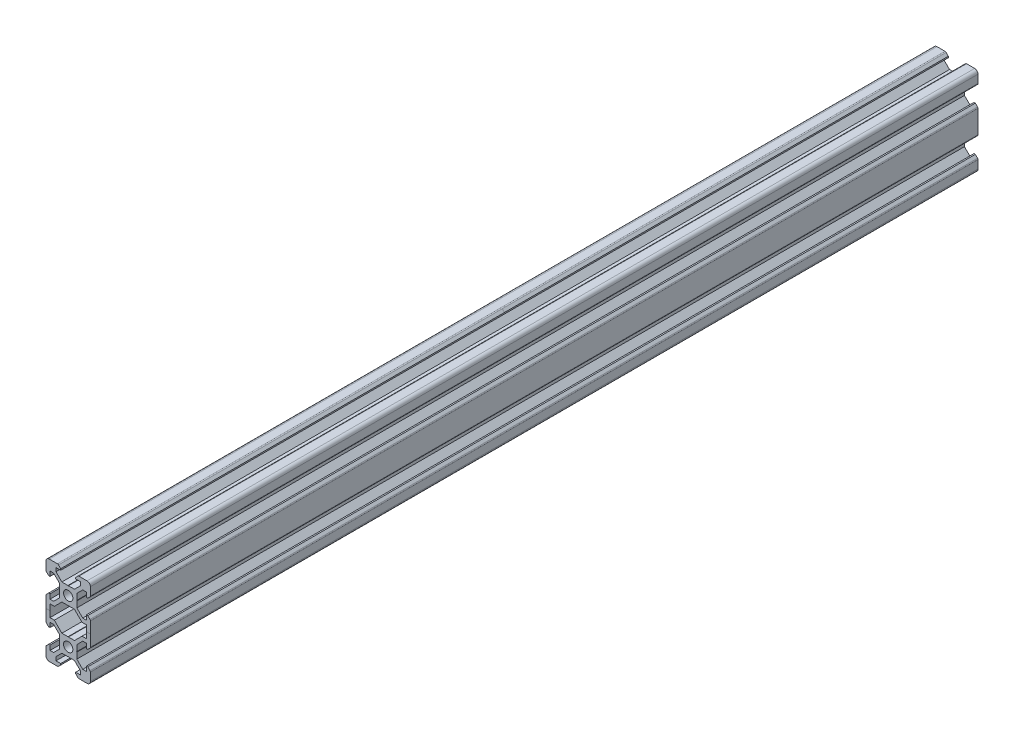
from build123d import *

# Parameters (mm, degrees)
SKETCH1_R           = 2.1
BOSS_EXTRUDE2_DEPTH = 400


with BuildPart() as part:
    # Sketch1 → Boss-Extrude2 (new body)
    with BuildSketch(Plane.XY):
        with BuildLine():
            Line((-8.5, 10), (-4.862792737, 10))
            ThreePointArc((-4.862792737, 10), (-4.598292737, 9.947387679), (-4.374060464, 9.797560464))
            Line((-4.374060464, 9.797560464), (-3.3865, 8.81))
            Line((-3.3865, 8.81), (-3.3865, 8.2))
            Line((-3.3865, 8.2), (-5.5, 8.2))
            Line((-5.5, 8.2), (-5.5, 6.561))
            Line((-5.5, 6.561), (-2.8395, 3.9005))
            Line((-2.8395, 3.9005), (-0.1, 3.9005))
            Line((-0.1, 3.9005), (0, 3.8005))
            Line((0, 3.8005), (0.1, 3.9005))
            Line((0.1, 3.9005), (2.8395, 3.9005))
            Line((2.8395, 3.9005), (5.5, 6.561))
            Line((5.5, 6.561), (5.5, 8.2))
            Line((5.5, 8.2), (3.3865, 8.2))
            Line((3.3865, 8.2), (3.3865, 8.81))
            Line((3.3865, 8.81), (4.374060464, 9.797560464))
            ThreePointArc((4.374060464, 9.797560464), (4.598292737, 9.947387679), (4.862792737, 10))
            Line((4.862792737, 10), (8.5, 10))
            ThreePointArc((8.5, 10), (9.560660172, 9.560660172), (10, 8.5))
            Line((10, 8.5), (10, 4.862792737))
            ThreePointArc((10, 4.862792737), (9.947387679, 4.598292737), (9.797560464, 4.374060464))
            Line((9.797560464, 4.374060464), (8.81, 3.3865))
            Line((8.81, 3.3865), (8.2, 3.3865))
            Line((8.2, 3.3865), (8.2, 5.5))
            Line((8.2, 5.5), (6.561, 5.5))
            Line((6.561, 5.5), (3.9005, 2.8395))
            Line((3.9005, 2.8395), (3.9005, 0.1))
            Line((3.9005, 0.1), (3.8005, 0))
            Line((3.8005, 0), (3.9005, -0.1))
            Line((3.9005, -0.1), (3.9005, -2.8395))
            Line((3.9005, -2.8395), (6.561, -5.5))
            Line((6.561, -5.5), (8.2, -5.5))
            Line((8.2, -5.5), (8.2, -3.3865))
            Line((8.2, -3.3865), (8.81, -3.3865))
            Line((8.81, -3.3865), (9.797560464, -4.374060464))
            ThreePointArc((9.797560464, -4.374060464), (9.947387679, -4.598292737), (10, -4.862792737))
            Line((10, -4.862792737), (10, -15.137207263))
            ThreePointArc((10, -15.137207263), (9.947387679, -15.401707263), (9.797560464, -15.625939536))
            Line((9.797560464, -15.625939536), (8.81, -16.6135))
            Line((8.81, -16.6135), (8.2, -16.6135))
            Line((8.2, -16.6135), (8.2, -14.5))
            Line((8.2, -14.5), (6.561, -14.5))
            Line((6.561, -14.5), (3.9005, -17.1605))
            Line((3.9005, -17.1605), (3.9005, -19.9))
            Line((3.9005, -19.9), (3.8005, -20))
            Line((3.8005, -20), (3.9005, -20.1))
            Line((3.9005, -20.1), (3.9005, -22.8395))
            Line((3.9005, -22.8395), (6.561, -25.5))
            Line((6.561, -25.5), (8.2, -25.5))
            Line((8.2, -25.5), (8.2, -23.3865))
            Line((8.2, -23.3865), (8.81, -23.3865))
            Line((8.81, -23.3865), (9.797560464, -24.374060464))
            ThreePointArc((9.797560464, -24.374060464), (9.947387679, -24.598292737), (10, -24.862792737))
            Line((10, -24.862792737), (10, -28.5))
            ThreePointArc((10, -28.5), (9.560660172, -29.560660172), (8.5, -30))
            Line((8.5, -30), (4.862792737, -30))
            ThreePointArc((4.862792737, -30), (4.598292737, -29.947387679), (4.374060464, -29.797560464))
            Line((4.374060464, -29.797560464), (3.3865, -28.81))
            Line((3.3865, -28.81), (3.3865, -28.2))
            Line((3.3865, -28.2), (5.5, -28.2))
            Line((5.5, -28.2), (5.5, -26.561))
            Line((5.5, -26.561), (2.8395, -23.9005))
            Line((2.8395, -23.9005), (0.1, -23.9005))
            Line((0.1, -23.9005), (0, -23.8005))
            Line((0, -23.8005), (-0.1, -23.9005))
            Line((-0.1, -23.9005), (-2.8395, -23.9005))
            Line((-2.8395, -23.9005), (-5.5, -26.561))
            Line((-5.5, -26.561), (-5.5, -28.2))
            Line((-5.5, -28.2), (-3.3865, -28.2))
            Line((-3.3865, -28.2), (-3.3865, -28.81))
            Line((-3.3865, -28.81), (-4.374060464, -29.797560464))
            ThreePointArc((-4.374060464, -29.797560464), (-4.598292737, -29.947387679), (-4.862792737, -30))
            Line((-4.862792737, -30), (-8.5, -30))
            ThreePointArc((-8.5, -30), (-9.560660172, -29.560660172), (-10, -28.5))
            Line((-10, -28.5), (-10, -24.862792737))
            ThreePointArc((-10, -24.862792737), (-9.947387679, -24.598292737), (-9.797560464, -24.374060464))
            Line((-9.797560464, -24.374060464), (-8.81, -23.3865))
            Line((-8.81, -23.3865), (-8.2, -23.3865))
            Line((-8.2, -23.3865), (-8.2, -25.5))
            Line((-8.2, -25.5), (-6.561, -25.5))
            Line((-6.561, -25.5), (-3.9005, -22.8395))
            Line((-3.9005, -22.8395), (-3.9005, -20.1))
            Line((-3.9005, -20.1), (-3.8005, -20))
            Line((-3.8005, -20), (-3.9005, -19.9))
            Line((-3.9005, -19.9), (-3.9005, -17.1605))
            Line((-3.9005, -17.1605), (-6.561, -14.5))
            Line((-6.561, -14.5), (-8.2, -14.5))
            Line((-8.2, -14.5), (-8.2, -16.6135))
            Line((-8.2, -16.6135), (-8.81, -16.6135))
            Line((-8.81, -16.6135), (-9.797560464, -15.625939536))
            ThreePointArc((-9.797560464, -15.625939536), (-9.947387679, -15.401707263), (-10, -15.137207263))
            Line((-10, -15.137207263), (-10, -4.862792737))
            ThreePointArc((-10, -4.862792737), (-9.947387679, -4.598292737), (-9.797560464, -4.374060464))
            Line((-9.797560464, -4.374060464), (-8.81, -3.3865))
            Line((-8.81, -3.3865), (-8.2, -3.3865))
            Line((-8.2, -3.3865), (-8.2, -5.5))
            Line((-8.2, -5.5), (-6.561, -5.5))
            Line((-6.561, -5.5), (-3.9005, -2.8395))
            Line((-3.9005, -2.8395), (-3.9005, -0.1))
            Line((-3.9005, -0.1), (-3.8005, 0))
            Line((-3.8005, 0), (-3.9005, 0.1))
            Line((-3.9005, 0.1), (-3.9005, 2.8395))
            Line((-3.9005, 2.8395), (-6.561, 5.5))
            Line((-6.561, 5.5), (-8.2, 5.5))
            Line((-8.2, 5.5), (-8.2, 3.3865))
            Line((-8.2, 3.3865), (-8.81, 3.3865))
            Line((-8.81, 3.3865), (-9.797560464, 4.374060464))
            ThreePointArc((-9.797560464, 4.374060464), (-9.947387679, 4.598292737), (-10, 4.862792737))
            Line((-10, 4.862792737), (-10, 8.5))
            ThreePointArc((-10, 8.5), (-9.560660172, 9.560660172), (-8.5, 10))
        make_face()
        Circle(SKETCH1_R, mode=Mode.SUBTRACT)
        with Locations((0, -20)):
            Circle(SKETCH1_R, mode=Mode.SUBTRACT)
        Polygon((-8.2, -12.7), (-8.2, -7.3), (-6.239, -7.3), (-5.5, -6.561), (-2.8395, -3.9005), (-0.1, -3.9005), (0, -3.8005), (0.1, -3.9005), (2.8395, -3.9005), (5.5, -6.561), (6.239, -7.3), (8.2, -7.3), (8.2, -12.7), (6.239, -12.7), (5.5, -13.439), (2.8395, -16.0995), (0.1, -16.0995), (0, -16.1995), (-0.1, -16.0995), (-2.8395, -16.0995), (-5.5, -13.439), (-6.239, -12.7), align=None, mode=Mode.SUBTRACT)
    extrude(amount=BOSS_EXTRUDE2_DEPTH)


solid = part.part
